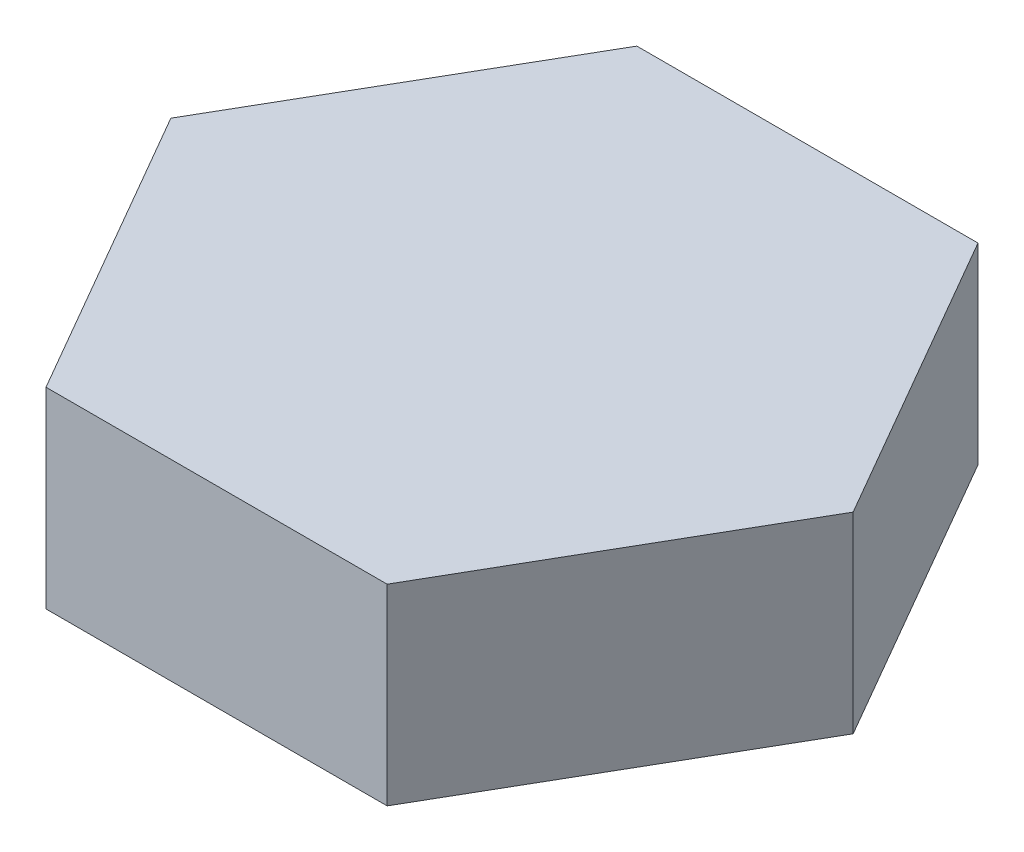
from build123d import *

# Parameters (mm, degrees)
BOSS_EXTRUDE1_DEPTH = 16.51


with BuildPart() as part:
    # Sketch1 → Boss-Extrude1 (new, symmetric)
    with BuildSketch(Plane(origin=(0, 0, 0), x_dir=(1, 0, 0), z_dir=(0, 1, 0))):
        Polygon((-58.65878735, 0), (-29.329393675, -50.8), (29.329393675, -50.8), (58.65878735, 0), (29.329393675, 50.8), (-29.329393675, 50.8), align=None)
    extrude(amount=BOSS_EXTRUDE1_DEPTH, both=True)


solid = part.part
